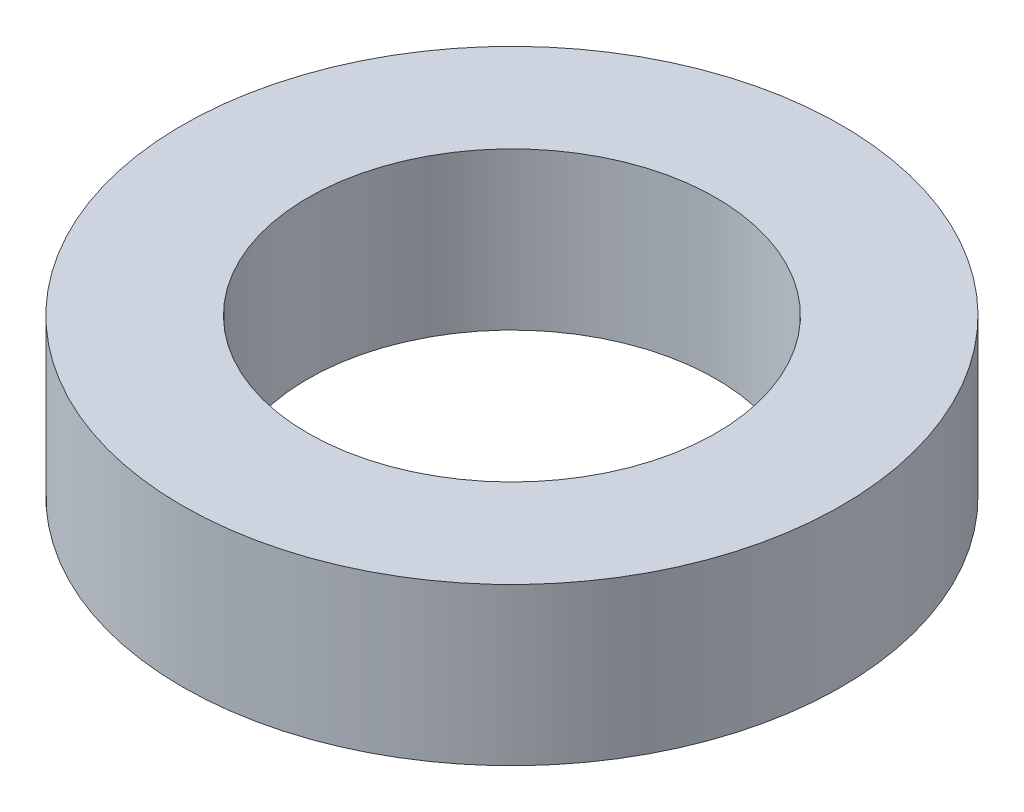
from build123d import *

# Parameters (mm, degrees)
SKETCH_1_R      = 10.5
SKETCH_1_R_2    = 6.5
EXTRUDE_1_DEPTH = 5


with BuildPart() as part:
    # Эскиз1 → Бобышка-Вытянуть1 (new body)
    with BuildSketch(Plane(origin=(0, 0, 0), x_dir=(1, 0, 0), z_dir=(0, 1, 0))):
        with Locations(Location((0, 0, 0), (0, 0, 270))):
            Circle(SKETCH_1_R)
        with Locations(Location((0, 0, 0), (0, 0, 270))):
            Circle(SKETCH_1_R_2, mode=Mode.SUBTRACT)
    extrude(amount=EXTRUDE_1_DEPTH)


solid = part.part
